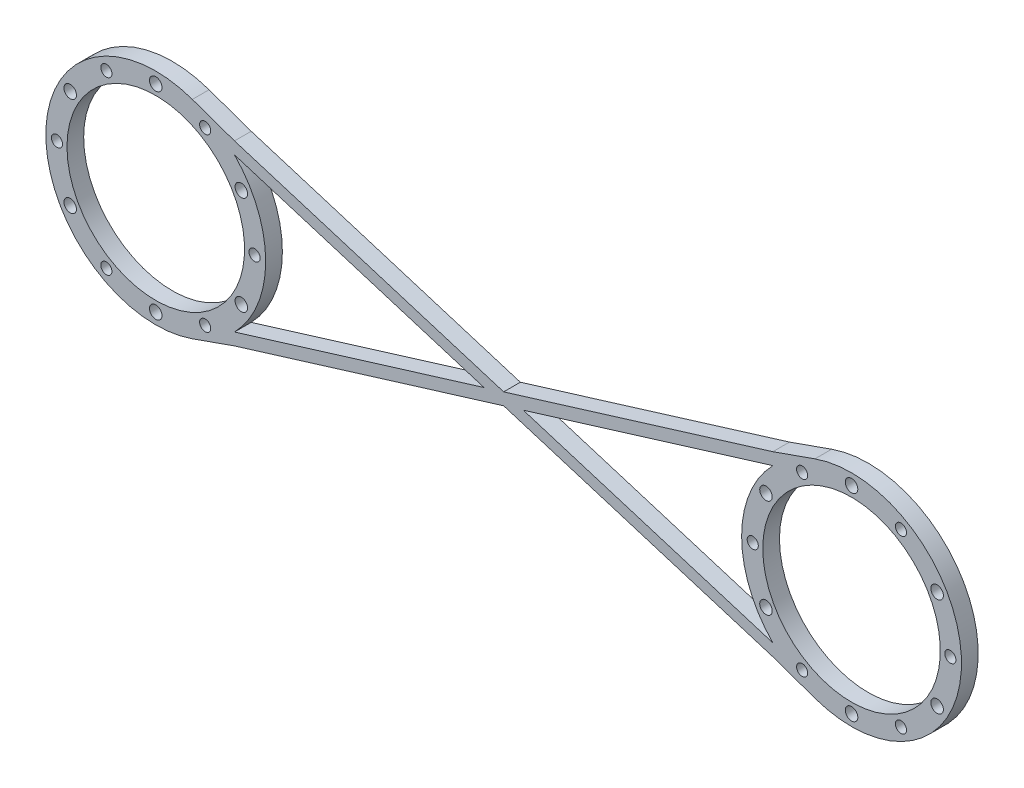
from build123d import *
from build123d.topology import SkipClean

# Parameters (mm, degrees)
EXTRUDE_1_DEPTH      = 8
SKETCH_2_R           = 2.5
CUT_EXTRUDE_1_DEPTH  = 8
SKETCH_3_R           = 15
CUT_EXTRUDE_3_DEPTH  = 8
SKETCH_4_R           = 25
EXTRUDE_2_DEPTH      = 8
SKETCH_6_R           = 15
CUT_EXTRUDE_6_DEPTH  = 8
SKETCH_9_R           = 39.5
EXTRUDE_3_DEPTH      = 8
SKETCH_10_R          = 15
CUT_EXTRUDE_7_DEPTH  = 8
FILLET_3_R           = 5
FILLET_4_R           = 5
FILLET_5_R           = 5
FILLET_6_R           = 5
SKETCH_11_R          = 20
CUT_EXTRUDE_9_DEPTH  = 188
SKETCH_12_R          = 2.25
SKETCH_12_R_2        = 2
CUT_EXTRUDE_10_DEPTH = 9
SKETCH_13_R          = 54.472977105
CUT_EXTRUDE_11_DEPTH = 2
SKETCH_14_R          = 59.15893828
CUT_EXTRUDE_12_DEPTH = 2
SKETCH_15_R          = 97.544160789
CUT_EXTRUDE_13_DEPTH = 14
SKETCH_16_R          = 31.9
CUT_EXTRUDE_14_DEPTH = 10
SKETCH_17_W          = 2.25
SKETCH_17_H          = 4.5
EXTRUDE_4_DEPTH      = 6
SKETCH_18_W          = 6
SKETCH_18_H          = 4.5
EXTRUDE_5_DEPTH      = 200
EXTRUDE_6_DEPTH      = 6
SKETCH_21_W          = 200
SKETCH_21_H          = 1.35
EXTRUDE_7_DEPTH      = 6
SKETCH_22_R          = 39.5
EXTRUDE_8_DEPTH      = 6
SKETCH_23_R          = 31.9
CUT_EXTRUDE_15_DEPTH = 6
SKETCH_26_W          = 23.294634575
SKETCH_26_H          = 7.6
EXTRUDE_9_DEPTH      = 6
SKETCH_27_R          = 2.25
SKETCH_27_R_2        = 2
CUT_EXTRUDE_16_DEPTH = 6
EXTRUDE_10_DEPTH     = 6
SKETCH_29_W          = 6
SKETCH_29_H          = 4.5
EXTRUDE_11_DEPTH     = 227
EXTRUDE_12_DEPTH     = 6
SKETCH_31_W          = 192.451548969
SKETCH_31_H          = 1.35
EXTRUDE_13_DEPTH     = 6
SKETCH_32_R          = 2
CUT_EXTRUDE_17_DEPTH = 6
SKETCH_33_R          = 2.25
CUT_EXTRUDE_18_DEPTH = 6
SKETCH_34_R          = 2
CUT_EXTRUDE_19_DEPTH = 6
SKETCH_35_R          = 2.25
CUT_EXTRUDE_20_DEPTH = 6
SKETCH_36_R          = 2.25
SKETCH_36_R_2        = 2
CUT_EXTRUDE_21_DEPTH = 6
SKETCH_37_R          = 39.5
EXTRUDE_14_DEPTH     = 6
SKETCH_38_R          = 31.9
CUT_EXTRUDE_22_DEPTH = 6
CUT_EXTRUDE_23_DEPTH = 6
SKETCH_40_W          = 83.199504535
SKETCH_40_H          = 7.6
EXTRUDE_15_DEPTH     = 6
SKETCH_41_W          = 83.199504535
SKETCH_41_H          = 7.6
EXTRUDE_16_DEPTH     = 6
SKETCH_42_R          = 2.25
CUT_EXTRUDE_24_DEPTH = 6
SKETCH_43_R          = 2
CUT_EXTRUDE_25_DEPTH = 6
EXTRUDE_17_DEPTH     = 6
EXTRUDE_18_DEPTH     = 6
CUT_EXTRUDE_26_DEPTH = 10
EXTRUDE_19_DEPTH     = 6
EXTRUDE_20_DEPTH     = 6
CUT_EXTRUDE_27_DEPTH = 6
EXTRUDE_21_DEPTH     = 6
EXTRUDE_22_DEPTH     = 6
SKETCH_54_R          = 3.023115784
SKETCH_54_R_2        = 3.087531329
SKETCH_54_R_3        = 3.121625289
SKETCH_54_R_4        = 2.992792855
SKETCH_54_R_5        = 3.413004947
SKETCH_54_R_6        = 2.595639541
SKETCH_54_R_7        = 3.020521319
SKETCH_54_R_8        = 2.981815249
SKETCH_54_R_9        = 2.623531365
SKETCH_54_R_10       = 2.954994935
SKETCH_54_R_11       = 2.920794483
SKETCH_54_R_12       = 2.880999884
EXTRUDE_26_DEPTH     = 6
SKETCH_55_R          = 2
SKETCH_55_R_2        = 2.25
CUT_EXTRUDE_28_DEPTH = 6
SKETCH_56_R          = 3.133153075
EXTRUDE_27_DEPTH     = 6
SKETCH_57_R          = 2
CUT_EXTRUDE_29_DEPTH = 6
SKETCH_58_R          = 3.393702045
EXTRUDE_28_DEPTH     = 6
SKETCH_59_R          = 2
CUT_EXTRUDE_30_DEPTH = 6
SKETCH_60_R          = 3.196495832
SKETCH_60_R_2        = 3.185485356
SKETCH_60_R_3        = 2.893528448
SKETCH_60_R_4        = 3.123896019
SKETCH_60_R_5        = 3.190377665
SKETCH_60_R_6        = 2.876275995
SKETCH_60_R_7        = 2.985325865
SKETCH_60_R_8        = 3.165524537
SKETCH_60_R_9        = 2.969778692
SKETCH_60_R_10       = 2.730957457
SKETCH_60_R_11       = 2.74773434
SKETCH_60_R_12       = 2
EXTRUDE_29_DEPTH     = 6
SKETCH_61_R          = 3.146480317
SKETCH_61_R_2        = 3.03649503
EXTRUDE_30_DEPTH     = 6
SKETCH_62_R          = 2
SKETCH_62_R_2        = 2.25
CUT_EXTRUDE_31_DEPTH = 6


with BuildPart() as part:
    # 草图1 → 凸台-拉伸1 (new body)
    with BuildSketch(Plane.XY):
        Polygon((0, 0), (28, 0), (28, -56), (-28, -56), (-28, 0), align=None)
    extrude(amount=EXTRUDE_1_DEPTH)

    # 草图2 → 切除-拉伸1 (cut)
    with BuildSketch(Plane(origin=(0, 0, 0), x_dir=(-1, 0, 0), z_dir=(0, 0, -1))):
        with Locations((-23.55, -4.45)):
            Circle(SKETCH_2_R)
        with Locations((23.55, -4.45)):
            Circle(SKETCH_2_R)
        with Locations((23.55, -51.55)):
            Circle(SKETCH_2_R)
        with Locations((-23.55, -51.55)):
            Circle(SKETCH_2_R)
    extrude(amount=-CUT_EXTRUDE_1_DEPTH, mode=Mode.SUBTRACT)

    # 草图3 → 切除-拉伸3 (cut)
    with BuildSketch(Plane(origin=(0, 0, 0), x_dir=(-1, 0, 0), z_dir=(0, 0, -1))):
        with Locations((0, -28)):
            Circle(SKETCH_3_R)
    extrude(amount=-CUT_EXTRUDE_3_DEPTH, mode=Mode.SUBTRACT)

    # 草图4 → 凸台-拉伸2 (add)
    with BuildSketch(Plane(origin=(0, 0, 0), x_dir=(-1, 0, 0), z_dir=(0, 0, -1))):
        with Locations((0, -28)):
            Circle(SKETCH_4_R)
    extrude(amount=EXTRUDE_2_DEPTH)

    # 草图6 → 切除-拉伸6 (cut)
    with BuildSketch(Plane(origin=(0, 0, -8), x_dir=(-1, 0, 0), z_dir=(0, 0, -1))):
        with Locations((0, -28)):
            Circle(SKETCH_6_R)
    extrude(amount=-CUT_EXTRUDE_6_DEPTH, mode=Mode.SUBTRACT)

    # 草图9 → 凸台-拉伸3 (add)
    with BuildSketch(Plane(origin=(0, 0, -8), x_dir=(-1, 0, 0), z_dir=(0, 0, -1))):
        with Locations((0, -28)):
            Circle(SKETCH_9_R)
    extrude(amount=EXTRUDE_3_DEPTH)

    # 草图10 → 切除-拉伸7 (cut)
    with BuildSketch(Plane(origin=(0, 0, -16), x_dir=(-1, 0, 0), z_dir=(0, 0, -1))):
        with Locations((0, -28)):
            Circle(SKETCH_10_R)
    extrude(amount=-CUT_EXTRUDE_7_DEPTH, mode=Mode.SUBTRACT)

    # 圆角3
    fillet_3_edges = [part.edges().sort_by_distance(p)[0] for p in [
        (-28, 0, 4),
    ]]
    fillet(fillet_3_edges, radius=FILLET_3_R)

    # 圆角4
    fillet_4_edges = [part.edges().sort_by_distance(p)[0] for p in [
        (28, 0, 4),
    ]]
    fillet(fillet_4_edges, radius=FILLET_4_R)

    # 圆角5
    fillet_5_edges = [part.edges().sort_by_distance(p)[0] for p in [
        (28, -56, 4),
    ]]
    fillet(fillet_5_edges, radius=FILLET_5_R)

    # 圆角6
    fillet_6_edges = [part.edges().sort_by_distance(p)[0] for p in [
        (-28, -56, 4),
    ]]
    fillet(fillet_6_edges, radius=FILLET_6_R)

    # 草图11 → 切除-拉伸9 (cut)
    with BuildSketch(Plane(origin=(0, 0, -16), x_dir=(-1, 0, 0), z_dir=(0, 0, -1))):
        with Locations((0, -28)):
            Circle(SKETCH_11_R)
    extrude(amount=-CUT_EXTRUDE_9_DEPTH, mode=Mode.SUBTRACT)

    # 草图12 → 切除-拉伸10 (cut)
    with BuildSketch(Plane(origin=(0, 0, -16), x_dir=(-1, 0, 0), z_dir=(0, 0, -1))):
        with Locations((0, 7.5)):
            Circle(SKETCH_12_R)
        with Locations((25.102290732, -2.897709268)):
            Circle(SKETCH_12_R)
        with Locations((35.5, -28)):
            Circle(SKETCH_12_R)
        with Locations((25.102290732, -53.102290732)):
            Circle(SKETCH_12_R)
        with Locations((0, -63.5)):
            Circle(SKETCH_12_R)
        with Locations((-25.102290732, -53.102290732)):
            Circle(SKETCH_12_R)
        with Locations((-35.5, -28)):
            Circle(SKETCH_12_R)
        with Locations((-25.102290732, -2.897709268)):
            Circle(SKETCH_12_R)
        with Locations((13.585261849, 4.797723404)):
            Circle(SKETCH_12_R_2)
        with Locations((32.797723404, -14.414738151)):
            Circle(SKETCH_12_R_2)
        with Locations((32.797723404, -41.585261849)):
            Circle(SKETCH_12_R_2)
        with Locations((13.585261849, -60.797723404)):
            Circle(SKETCH_12_R_2)
        with Locations((-13.585261849, -60.797723404)):
            Circle(SKETCH_12_R_2)
        with Locations((-32.797723404, -41.585261849)):
            Circle(SKETCH_12_R_2)
        with Locations((-32.797723404, -14.414738151)):
            Circle(SKETCH_12_R_2)
        with Locations((-13.585261849, 4.797723404)):
            Circle(SKETCH_12_R_2)
    extrude(amount=-CUT_EXTRUDE_10_DEPTH, mode=Mode.SUBTRACT)

    # 草图13 → 切除-拉伸11 (cut)
    with BuildSketch(Plane.XY.offset(8)):
        with Locations((-7.517789751, -22.291540896)):
            Circle(SKETCH_13_R)
    extrude(amount=-CUT_EXTRUDE_11_DEPTH, mode=Mode.SUBTRACT)

    # 草图14 → 切除-拉伸12 (cut)
    with BuildSketch(Plane(origin=(0, 0, -16), x_dir=(-1, 0, 0), z_dir=(0, 0, -1))):
        with Locations((0.99418985, -28.021684804)):
            Circle(SKETCH_14_R)
    extrude(amount=-CUT_EXTRUDE_12_DEPTH, mode=Mode.SUBTRACT)

    # 草图15 → 切除-拉伸13 (cut)
    with BuildSketch(Plane.XY.offset(6)):
        with Locations((21.387337294, -13.128331417)):
            Circle(SKETCH_15_R)
    extrude(amount=-CUT_EXTRUDE_13_DEPTH, mode=Mode.SUBTRACT)

    # 草图16 → 切除-拉伸14 (cut)
    with BuildSketch(Plane(origin=(0, 0, -14), x_dir=(-1, 0, 0), z_dir=(0, 0, -1))):
        with Locations((0, -28)):
            Circle(SKETCH_16_R)
    extrude(amount=-CUT_EXTRUDE_14_DEPTH, mode=Mode.SUBTRACT)

    # 草图17 → 凸台-拉伸4 (add)
    with BuildSketch(Plane(origin=(0, 0, -14), x_dir=(-1, 0, 0), z_dir=(0, 0, -1))):
        with Locations((1.125, -63.5)):
            Rectangle(SKETCH_17_W, SKETCH_17_H)
    extrude(amount=-EXTRUDE_4_DEPTH)

    # 草图18 → 凸台-拉伸5 (add)
    with BuildSketch(Plane(origin=(0, 0, 0), x_dir=(0, 0, -1), z_dir=(1, 0, 0))):
        with Locations((11, -63.5)):
            Rectangle(SKETCH_18_W, SKETCH_18_H)
    extrude(amount=EXTRUDE_5_DEPTH)

    # 草图19 → 凸台-拉伸6 (add)
    with BuildSketch(Plane(origin=(0, 0, -14), x_dir=(-1, 0, 0), z_dir=(0, 0, -1))):
        Polygon((-200, -65.75), (-200, -67.5), (-11.62498376, -67.5), (0, -67.5), (0, -65.75), (-11.627015954, -65.75), align=None)
    extrude(amount=-EXTRUDE_6_DEPTH)

    # 草图21 → 凸台-拉伸7 (add)
    with BuildSketch(Plane(origin=(0, 0, -14), x_dir=(-1, 0, 0), z_dir=(0, 0, -1))):
        with Locations((-100, -60.575)):
            Rectangle(SKETCH_21_W, SKETCH_21_H)
    extrude(amount=-EXTRUDE_7_DEPTH)



with BuildPart() as body_2:
    # 草图22 → 凸台-拉伸8 (new body)
    with BuildSketch(Plane(origin=(0, 0, -14), x_dir=(-1, 0, 0), z_dir=(0, 0, -1))):
        with Locations((-223.294634575, -28)):
            Circle(SKETCH_22_R)
    extrude(amount=-EXTRUDE_8_DEPTH)

    # 草图23 → 切除-拉伸15 (cut)
    with BuildSketch(Plane(origin=(0, 0, -14), x_dir=(-1, 0, 0), z_dir=(0, 0, -1))):
        with Locations((-223.294634575, -28)):
            Circle(SKETCH_23_R)
    extrude(amount=-CUT_EXTRUDE_15_DEPTH, mode=Mode.SUBTRACT)


with BuildPart() as part_1:
    add(part.part)

    add(body_2.part)  # 凸台-拉伸9 merges body 2
    # 草图26 → 凸台-拉伸9 (add)
    with BuildSketch(Plane(origin=(0, 0, -14), x_dir=(-1, 0, 0), z_dir=(0, 0, -1))):
        with Locations((-211.647317288, -63.7)):
            Rectangle(SKETCH_26_W, SKETCH_26_H)
    extrude(amount=-EXTRUDE_9_DEPTH)

    # 草图27 → 切除-拉伸16 (cut)
    with BuildSketch(Plane(origin=(0, 0, -14), x_dir=(-1, 0, 0), z_dir=(0, 0, -1))):
        with Locations((-223.294634575, 7.5)):
            Circle(SKETCH_27_R)
        with Locations((-198.192343843, -2.897709268)):
            Circle(SKETCH_27_R)
        with Locations((-187.794634575, -28)):
            Circle(SKETCH_27_R)
        with Locations((-198.192343843, -53.102290732)):
            Circle(SKETCH_27_R)
        with Locations((-223.294634575, -63.5)):
            Circle(SKETCH_27_R)
        with Locations((-248.396925307, -53.102290732)):
            Circle(SKETCH_27_R)
        with Locations((-258.794634575, -28)):
            Circle(SKETCH_27_R)
        with Locations((-248.396925307, -2.897709268)):
            Circle(SKETCH_27_R)
        with Locations((-209.709372726, 4.797723404)):
            Circle(SKETCH_27_R_2)
        with Locations((-190.496911171, -14.414738151)):
            Circle(SKETCH_27_R_2)
        with Locations((-190.496911171, -41.585261849)):
            Circle(SKETCH_27_R_2)
        with Locations((-209.709372726, -60.797723404)):
            Circle(SKETCH_27_R_2)
        with Locations((-236.879896424, -60.797723404)):
            Circle(SKETCH_27_R_2)
        with Locations((-256.09235798, -41.585261849)):
            Circle(SKETCH_27_R_2)
        with Locations((-256.09235798, -14.414738151)):
            Circle(SKETCH_27_R_2)
        with Locations((-236.879896424, 4.797723404)):
            Circle(SKETCH_27_R_2)
    extrude(amount=-CUT_EXTRUDE_16_DEPTH, mode=Mode.SUBTRACT)

    # 草图28 → 凸台-拉伸10 (add)
    with BuildSketch(Plane(origin=(0, 0, -14), x_dir=(-1, 0, 0), z_dir=(0, 0, -1))):
        Polygon((-223.294634575, 5.25), (-223.294634575, 7.5), (-223.294634575, 9.75), (-221.044634575, 9.75), (-221.044634575, 5.25), align=None)
    extrude(amount=-EXTRUDE_10_DEPTH)

    # 草图29 → 凸台-拉伸11 (add)
    with BuildSketch(Plane(origin=(223.294634575, 0, 0), x_dir=(0, 0, -1), z_dir=(1, 0, 0))):
        with Locations((11, 7.5)):
            Rectangle(SKETCH_29_W, SKETCH_29_H)
    extrude(amount=-EXTRUDE_11_DEPTH)

    # 草图30 → 凸台-拉伸12 (add)
    with BuildSketch(Plane(origin=(0, 0, -14), x_dir=(-1, 0, 0), z_dir=(0, 0, -1))):
        Polygon((-11.627015954, 11.5), (0, 11.5), (0, 9.75), (-223.294634575, 9.75), (-223.294634575, 11.5), align=None)
    extrude(amount=-EXTRUDE_12_DEPTH)

    # 草图31 → 凸台-拉伸13 (add)
    with BuildSketch(Plane(origin=(0, 0, -14), x_dir=(-1, 0, 0), z_dir=(0, 0, -1))):
        with Locations((-105.745457454, 4.575)):
            Rectangle(SKETCH_31_W, SKETCH_31_H)
    extrude(amount=-EXTRUDE_13_DEPTH)

    # 草图32 → 切除-拉伸17 (cut)
    with BuildSketch(Plane(origin=(0, 0, -14), x_dir=(-1, 0, 0), z_dir=(0, 0, -1))):
        with Locations((-13.585261849, 4.797723404)):
            Circle(SKETCH_32_R)
    extrude(amount=-CUT_EXTRUDE_17_DEPTH, mode=Mode.SUBTRACT)

    # 草图33 → 切除-拉伸18 (cut)
    with BuildSketch(Plane(origin=(0, 0, -14), x_dir=(-1, 0, 0), z_dir=(0, 0, -1))):
        with Locations((0, 7.5)):
            Circle(SKETCH_33_R)
    extrude(amount=-CUT_EXTRUDE_18_DEPTH, mode=Mode.SUBTRACT)

    # 草图34 → 切除-拉伸19 (cut)
    with BuildSketch(Plane(origin=(0, 0, -14), x_dir=(-1, 0, 0), z_dir=(0, 0, -1))):
        with Locations((-13.585261849, -60.797723404)):
            Circle(SKETCH_34_R)
    extrude(amount=-CUT_EXTRUDE_19_DEPTH, mode=Mode.SUBTRACT)

    # 草图35 → 切除-拉伸20 (cut)
    with BuildSketch(Plane(origin=(0, 0, -14), x_dir=(-1, 0, 0), z_dir=(0, 0, -1))):
        with Locations((0, -63.5)):
            Circle(SKETCH_35_R)
    extrude(amount=-CUT_EXTRUDE_20_DEPTH, mode=Mode.SUBTRACT)

    # 草图36 → 切除-拉伸21 (cut)
    with BuildSketch(Plane(origin=(0, 0, -14), x_dir=(-1, 0, 0), z_dir=(0, 0, -1))):
        with Locations((-223.294634575, 7.5)):
            Circle(SKETCH_36_R)
        with Locations((-209.709372726, 4.797723404)):
            Circle(SKETCH_36_R_2)
    extrude(amount=-CUT_EXTRUDE_21_DEPTH, mode=Mode.SUBTRACT)

    # 草图37 → 凸台-拉伸14 (add)
    with BuildSketch(Plane(origin=(0, 0, -14), x_dir=(-1, 0, 0), z_dir=(0, 0, -1))):
        with Locations((26.705365425, -28)):
            Circle(SKETCH_37_R)
    extrude(amount=-EXTRUDE_14_DEPTH)

    # 草图38 → 切除-拉伸22 (cut)
    with BuildSketch(Plane(origin=(0, 0, -14), x_dir=(-1, 0, 0), z_dir=(0, 0, -1))):
        with Locations((26.705365425, -28)):
            Circle(SKETCH_38_R)
    extrude(amount=-CUT_EXTRUDE_22_DEPTH, mode=Mode.SUBTRACT)

    # 草图39 → 切除-拉伸23 (cut)
    with BuildSketch(Plane(origin=(0, 0, -14), x_dir=(-1, 0, 0), z_dir=(0, 0, -1))):
        with BuildLine():
            Line((13.352682712, 9.174666971), (-4.992405211, 19.110142944))
            Line((-4.992405211, 19.110142944), (-56.49413911, 19.110142944))
            Line((-56.49413911, 19.110142944), (-56.49413911, -75.983825288))
            Line((-56.49413911, -75.983825288), (13.352682712, -75.983825288))
            Line((13.352682712, -75.983825288), (13.352682712, -65.174666971))
            ThreePointArc((13.352682712, -65.174666971), (-12.794634575, -28), (13.352682712, 9.174666971))
        make_face()
    extrude(amount=-CUT_EXTRUDE_23_DEPTH, mode=Mode.SUBTRACT)


with BuildPart() as cut_extrude_23_piece_1:
    # of the separate pieces the step leaves, piece 1, a body of its own (cut_extrude_23_pieces)
    add(part_1.part.solids().sort_by_distance((56.49413911, -59.9, -8))[0])



with BuildPart() as cut_extrude_23_piece_2:
    # of the separate pieces the step leaves, piece 2, a body of its own (cut_extrude_23_pieces)
    add(part_1.part.solids().sort_by_distance((-13.352682712, 9.174666971, -8))[0])


with BuildPart() as cut_extrude_23_piece_1_1:
    with SkipClean():  # the faces are left unmerged after this step: merging them gives an invalid solid
        add(cut_extrude_23_piece_1.part)

        add(cut_extrude_23_piece_2.part)  # 凸台-拉伸15 merges 切除-拉伸23 piece 2
        # 草图40 → 凸台-拉伸15 (add)
        with BuildSketch(Plane(origin=(0, 0, -14), x_dir=(-1, 0, 0), z_dir=(0, 0, -1))):
            with Locations((-14.894386843, 7.7)):
                Rectangle(SKETCH_40_W, SKETCH_40_H)
        extrude(amount=-EXTRUDE_15_DEPTH)

    # 草图41 → 凸台-拉伸16 (add)
    with SkipClean():  # the faces are left unmerged after this step: merging them gives an invalid solid
        with BuildSketch(Plane(origin=(0, 0, -14), x_dir=(-1, 0, 0), z_dir=(0, 0, -1))):
            with Locations((-14.894386843, -63.7)):
                Rectangle(SKETCH_41_W, SKETCH_41_H)
        extrude(amount=-EXTRUDE_16_DEPTH)

    # 草图42 → 切除-拉伸24 (cut)
    with SkipClean():  # the faces are left unmerged after this step: merging them gives an invalid solid
        with BuildSketch(Plane(origin=(0, 0, -14), x_dir=(-1, 0, 0), z_dir=(0, 0, -1))):
            with Locations((26.705365425, -63.5)):
                Circle(SKETCH_42_R)
            with Locations((1.603074693, -53.102290732)):
                Circle(SKETCH_42_R)
            with Locations((-8.794634575, -28)):
                Circle(SKETCH_42_R)
            with Locations((1.603074693, -2.897709268)):
                Circle(SKETCH_42_R)
            with Locations((26.705365425, 7.5)):
                Circle(SKETCH_42_R)
            with Locations((51.807656157, -2.897709268)):
                Circle(SKETCH_42_R)
            with Locations((62.205365425, -28)):
                Circle(SKETCH_42_R)
            with Locations((51.807656157, -53.102290732)):
                Circle(SKETCH_42_R)
        extrude(amount=-CUT_EXTRUDE_24_DEPTH, mode=Mode.SUBTRACT)

    # 草图43 → 切除-拉伸25 (cut)
    with SkipClean():  # the faces are left unmerged after this step: merging them gives an invalid solid
        with BuildSketch(Plane(origin=(0, 0, -14), x_dir=(-1, 0, 0), z_dir=(0, 0, -1))):
            with Locations((13.120103576, -60.797723404)):
                Circle(SKETCH_43_R)
            with Locations((-6.09235798, -41.585261849)):
                Circle(SKETCH_43_R)
            with Locations((-6.09235798, -14.414738151)):
                Circle(SKETCH_43_R)
            with Locations((13.120103576, 4.797723404)):
                Circle(SKETCH_43_R)
            with Locations((40.290627274, 4.797723404)):
                Circle(SKETCH_43_R)
            with Locations((59.503088829, -14.414738151)):
                Circle(SKETCH_43_R)
            with Locations((59.503088829, -41.585261849)):
                Circle(SKETCH_43_R)
            with Locations((40.290627274, -60.797723404)):
                Circle(SKETCH_43_R)
        extrude(amount=-CUT_EXTRUDE_25_DEPTH, mode=Mode.SUBTRACT)

    # 草图45 → 凸台-拉伸17 (add)
    with SkipClean():  # the faces are left unmerged after this step: merging them gives an invalid solid
        with BuildSketch(Plane(origin=(0, 0, -14), x_dir=(-1, 0, 0), z_dir=(0, 0, -1))):
            Polygon((3.410730849, 3.9), (-1.589269151, 3.9), (-195, -55.561996558), (-196.053089168, -55.561996558), (-200, -59.9), (-195, -59.9), (-1.589269151, -0.438003442), (-0.326462053, -0.207504924), align=None)
        extrude(amount=-EXTRUDE_17_DEPTH)

    # 草图46 → 凸台-拉伸18 (add)
    with BuildSketch(Plane(origin=(0, 0, -14), x_dir=(-1, 0, 0), z_dir=(0, 0, -1))):
        Polygon((3.410730849, -59.9), (-1.589269151, -59.9), (-195, -0.438003442), (-198.220472374, 0.638318988), (-200, 3.9), (-195, 3.9), (-1.589269151, -55.561996558), (3.410730849, -56.654151934), align=None)
    extrude(amount=-EXTRUDE_18_DEPTH)

    # 草图48 → 切除-拉伸26 (cut)
    with BuildSketch(Plane(origin=(0, 0, -14), x_dir=(-1, 0, 0), z_dir=(0, 0, -1))):
        with BuildLine():
            Line((-195, 3.9), (-200, 3.9))
            ThreePointArc((-200, 3.9), (-211.043104059, 9.551963997), (-223.294634575, 11.5))
            Line((-223.294634575, 11.5), (26.705365425, 11.5))
            ThreePointArc((26.705365425, 11.5), (14.453834908, 9.551963997), (3.410730849, 3.9))
            Line((3.410730849, 3.9), (-195, 3.9))
        make_face()
    extrude(amount=-CUT_EXTRUDE_26_DEPTH, mode=Mode.SUBTRACT)

    # 草图49 → 凸台-拉伸19 (add)
    with BuildSketch(Plane(origin=(0, 0, -14), x_dir=(-1, 0, 0), z_dir=(0, 0, -1))):
        Polygon((-195, 3.9), (-210.144570146, 9.246822757), (-203.428919575, 3.9), (-195.687194707, 2.184984953), align=None)
    extrude(amount=-EXTRUDE_19_DEPTH)

    # 草图50 → 凸台-拉伸20 (add)
    with BuildSketch(Plane(origin=(0, 0, -14), x_dir=(-1, 0, 0), z_dir=(0, 0, -1))):
        Polygon((-1.589269151, 3.9), (13.555268797, 9.246811389), (12.484470378, 7.007301608), (5.165672919, 2.143463843), align=None)
    extrude(amount=-EXTRUDE_20_DEPTH)

    # 草图51 → 切除-拉伸27 (cut)
    with BuildSketch(Plane(origin=(0, 0, -14), x_dir=(-1, 0, 0), z_dir=(0, 0, -1))):
        with BuildLine():
            Line((-195, -59.9), (-200, -59.9))
            ThreePointArc((-200, -59.9), (-211.043104059, -65.551963997), (-223.294634575, -67.5))
            Line((-223.294634575, -67.5), (26.705365425, -67.5))
            ThreePointArc((26.705365425, -67.5), (14.453834908, -65.551963997), (3.410730849, -59.9))
            Line((3.410730849, -59.9), (-195, -59.9))
        make_face()
    extrude(amount=-CUT_EXTRUDE_27_DEPTH, mode=Mode.SUBTRACT)

    # 草图52 → 凸台-拉伸21 (add)
    with BuildSketch(Plane(origin=(0, 0, -14), x_dir=(-1, 0, 0), z_dir=(0, 0, -1))):
        Polygon((-195, -59.9), (-210.144521964, -65.246805746), (-210.144521964, -63.833151631), (-204.448758461, -59.9), (-198.056465546, -58.898278458), align=None)
    extrude(amount=-EXTRUDE_21_DEPTH)

    # 草图53 → 凸台-拉伸22 (add)
    with BuildSketch(Plane(origin=(0, 0, -14), x_dir=(-1, 0, 0), z_dir=(0, 0, -1))):
        Polygon((-1.589269151, -59.9), (13.555306721, -65.246824779), (13.952087813, -64.122964992), (8.19702609, -60.976256257), (3.998941814, -56.874336201), align=None)
    extrude(amount=-EXTRUDE_22_DEPTH)

    # 草图54 → 凸台-拉伸26 (add)
    with BuildSketch(Plane(origin=(0, 0, -14), x_dir=(-1, 0, 0), z_dir=(0, 0, -1))):
        with Locations((-209.676875906, 5.562719426)):
            Circle(SKETCH_54_R)
        with Locations((-198.192343843, -2.897709268)):
            Circle(SKETCH_54_R_2)
        with Locations((-190.167602493, -13.95776797)):
            Circle(SKETCH_54_R_3)
        with Locations((-190.496911171, -41.585261849)):
            Circle(SKETCH_54_R_4)
        with Locations((-198.192343843, -53.102290732)):
            Circle(SKETCH_54_R_5)
        with Locations((-209.709372726, -60.614928584)):
            Circle(SKETCH_54_R_6)
        with Locations((-236.879896424, -60.797723404)):
            Circle(SKETCH_54_R_7)
        with Locations((-248.396925307, -53.102290732)):
            Circle(SKETCH_54_R_8)
        with Locations((-256.09235798, -41.585261849)):
            Circle(SKETCH_54_R_9)
        with Locations((-256.09235798, -14.414738151)):
            Circle(SKETCH_54_R_10)
        with Locations((-248.396925307, -2.897709268)):
            Circle(SKETCH_54_R_11)
        with Locations((-236.879896424, 4.797723404)):
            Circle(SKETCH_54_R_12)
    extrude(amount=-EXTRUDE_26_DEPTH)

    # 草图55 → 切除-拉伸28 (cut)
    with BuildSketch(Plane(origin=(0, 0, -14), x_dir=(-1, 0, 0), z_dir=(0, 0, -1))):
        with Locations((-205.544634575, 2.743901834)):
            Circle(SKETCH_55_R)
        with Locations((-192.550732741, -10.25)):
            Circle(SKETCH_55_R_2)
        with Locations((-192.550732741, -45.75)):
            Circle(SKETCH_55_R_2)
        with Locations((-205.544634575, -58.743901834)):
            Circle(SKETCH_55_R)
        with Locations((-241.044634575, -58.743901834)):
            Circle(SKETCH_55_R)
        with Locations((-254.03853641, -45.75)):
            Circle(SKETCH_55_R_2)
        with Locations((-254.03853641, -10.25)):
            Circle(SKETCH_55_R_2)
        with Locations((-241.044634575, 2.743901834)):
            Circle(SKETCH_55_R)
    extrude(amount=-CUT_EXTRUDE_28_DEPTH, mode=Mode.SUBTRACT)

    # 草图56 → 凸台-拉伸27 (add)
    with BuildSketch(Plane(origin=(0, 0, -14), x_dir=(-1, 0, 0), z_dir=(0, 0, -1))):
        with Locations((-187.88108434, -28.12111643)):
            Circle(SKETCH_56_R)
    extrude(amount=-EXTRUDE_27_DEPTH)

    # 草图57 → 切除-拉伸29 (cut)
    with BuildSketch(Plane(origin=(0, 0, -14), x_dir=(-1, 0, 0), z_dir=(0, 0, -1))):
        with Locations((-187.794634575, -28)):
            Circle(SKETCH_57_R)
    extrude(amount=-CUT_EXTRUDE_29_DEPTH, mode=Mode.SUBTRACT)

    # 草图58 → 凸台-拉伸28 (add)
    with BuildSketch(Plane(origin=(0, 0, -14), x_dir=(-1, 0, 0), z_dir=(0, 0, -1))):
        with Locations((-258.794634575, -28)):
            Circle(SKETCH_58_R)
    extrude(amount=-EXTRUDE_28_DEPTH)

    # 草图59 → 切除-拉伸30 (cut)
    with BuildSketch(Plane(origin=(0, 0, -14), x_dir=(-1, 0, 0), z_dir=(0, 0, -1))):
        with Locations((-258.794634575, -28)):
            Circle(SKETCH_59_R)
    extrude(amount=-CUT_EXTRUDE_30_DEPTH, mode=Mode.SUBTRACT)

    # 草图60 → 凸台-拉伸29 (add)
    with BuildSketch(Plane(origin=(0, 0, -14), x_dir=(-1, 0, 0), z_dir=(0, 0, -1))):
        with Locations((40.330376882, 4.930819427)):
            Circle(SKETCH_60_R)
        with Locations((51.807656157, -2.897709268)):
            Circle(SKETCH_60_R_2)
        with Locations((59.503088829, -14.414738151)):
            Circle(SKETCH_60_R_3)
        with Locations((59.503088829, -41.585261849)):
            Circle(SKETCH_60_R_4)
        with Locations((51.807656157, -53.102290732)):
            Circle(SKETCH_60_R_5)
        with Locations((40.290627274, -60.797723404)):
            Circle(SKETCH_60_R_6)
        with Locations((13.120103576, -60.797723404)):
            Circle(SKETCH_60_R_7)
        with Locations((1.603074693, -53.102290732)):
            Circle(SKETCH_60_R_8)
        with Locations((-6.09235798, -41.585261849)):
            Circle(SKETCH_60_R_9)
        with Locations((-6.09235798, -14.414738151)):
            Circle(SKETCH_60_R_10)
        with Locations((1.603074693, -2.897709268)):
            Circle(SKETCH_60_R_11)
        with Locations((13.120103576, 4.797723404)):
            Circle(SKETCH_60_R_12)
    extrude(amount=-EXTRUDE_29_DEPTH)

    # 草图61 → 凸台-拉伸30 (add)
    with BuildSketch(Plane(origin=(0, 0, -14), x_dir=(-1, 0, 0), z_dir=(0, 0, -1))):
        with Locations((62.205365425, -28)):
            Circle(SKETCH_61_R)
        with Locations((-8.794634575, -28)):
            Circle(SKETCH_61_R_2)
    extrude(amount=-EXTRUDE_30_DEPTH)

    # 草图62 → 切除-拉伸31 (cut)
    with BuildSketch(Plane(origin=(0, 0, -14), x_dir=(-1, 0, 0), z_dir=(0, 0, -1))):
        with Locations((44.455365425, 2.743901834)):
            Circle(SKETCH_62_R)
        with Locations((62.205365425, -28)):
            Circle(SKETCH_62_R)
        with Locations((44.455365425, -58.743901834)):
            Circle(SKETCH_62_R)
        with Locations((8.955365425, -58.743901834)):
            Circle(SKETCH_62_R)
        with Locations((-8.794634575, -28)):
            Circle(SKETCH_62_R)
        with Locations((8.955365425, 2.743901834)):
            Circle(SKETCH_62_R)
        with Locations((57.449267259, -10.25)):
            Circle(SKETCH_62_R_2)
        with Locations((57.449267259, -45.75)):
            Circle(SKETCH_62_R_2)
        with Locations((-4.03853641, -45.75)):
            Circle(SKETCH_62_R_2)
        with Locations((-4.03853641, -10.25)):
            Circle(SKETCH_62_R_2)
    extrude(amount=-CUT_EXTRUDE_31_DEPTH, mode=Mode.SUBTRACT)


solid = cut_extrude_23_piece_1_1.part
